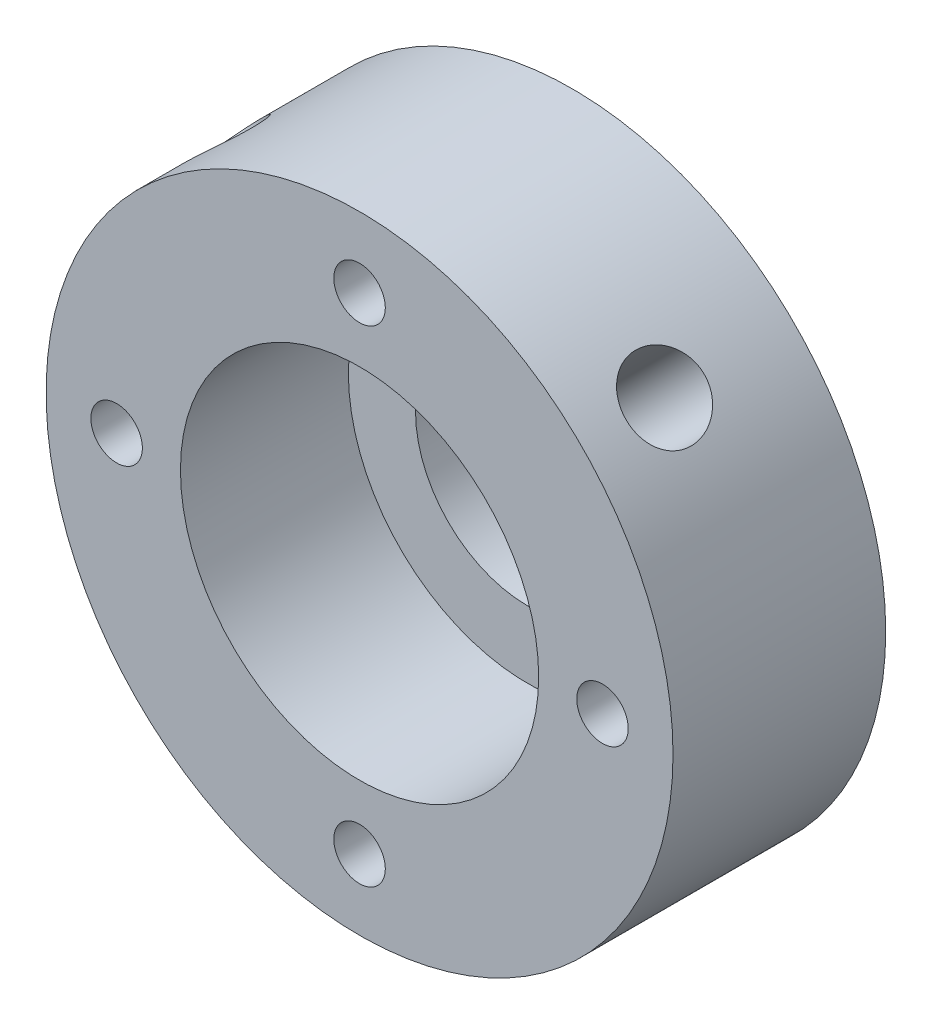
from build123d import *

# Parameters (mm, degrees)
SKETCH1_R           = 14
BOSS_EXTRUDE1_DEPTH = 2
SKETCH2_R           = 14
SKETCH2_R_2         = 8
BOSS_EXTRUDE2_DEPTH = 7.5
SKETCH3_R           = 5
CUT_EXTRUDE1_DEPTH  = 2
SKETCH5_R           = 1.15
CUT_EXTRUDE2_DEPTH  = 22.960191256
SKETCH7_R           = 1.75
CUT_EXTRUDE3_DEPTH  = 7
SKETCH9_R           = 1.75
CUT_EXTRUDE4_DEPTH  = 7


with BuildPart() as part:
    # Sketch1 → Boss-Extrude1 (new body)
    with BuildSketch(Plane.XY):
        Circle(SKETCH1_R)
    extrude(amount=BOSS_EXTRUDE1_DEPTH)

    # Sketch2 → Boss-Extrude2 (add)
    with BuildSketch(Plane.XY.offset(2)):
        Circle(SKETCH2_R)
        Circle(SKETCH2_R_2, mode=Mode.SUBTRACT)
    extrude(amount=BOSS_EXTRUDE2_DEPTH)

    # Sketch3 → Cut-Extrude1 (cut)
    with BuildSketch(Plane(origin=(0, 0, 0), x_dir=(-1, 0, 0), z_dir=(0, 0, -1))):
        Circle(SKETCH3_R)
    extrude(amount=-CUT_EXTRUDE1_DEPTH, mode=Mode.SUBTRACT)

    # Sketch5 → Cut-Extrude2 (cut, through all)
    with BuildSketch(Plane.XY.offset(9.5)):
        with Locations((0, 10.85)):
            Circle(SKETCH5_R)
        with Locations((10.85, 0)):
            Circle(SKETCH5_R)
        with Locations((0, -10.85)):
            Circle(SKETCH5_R)
        with Locations((-10.85, 0)):
            Circle(SKETCH5_R)
    extrude(amount=-CUT_EXTRUDE2_DEPTH, mode=Mode.SUBTRACT)

    # Sketch7 → Cut-Extrude3 (cut)
    with BuildSketch(Plane(origin=(9.899494937, 9.899494937, 0), x_dir=(0.7071067811865489, -0.7071067811865461, 0), z_dir=(0.7071067811865461, 0.7071067811865489, 0))):
        with Locations((0, -5.75)):
            Circle(SKETCH7_R)
    extrude(amount=-CUT_EXTRUDE3_DEPTH, mode=Mode.SUBTRACT)

    # Sketch9 → Cut-Extrude4 (cut)
    with BuildSketch(Plane(origin=(-9.899494937, 9.899494937, 0), x_dir=(0, 0, 1), z_dir=(-0.7071067811865489, 0.7071067811865462, 0))):
        with Locations((5.75, 0)):
            Circle(SKETCH9_R)
    extrude(amount=-CUT_EXTRUDE4_DEPTH, mode=Mode.SUBTRACT)


solid = part.part
